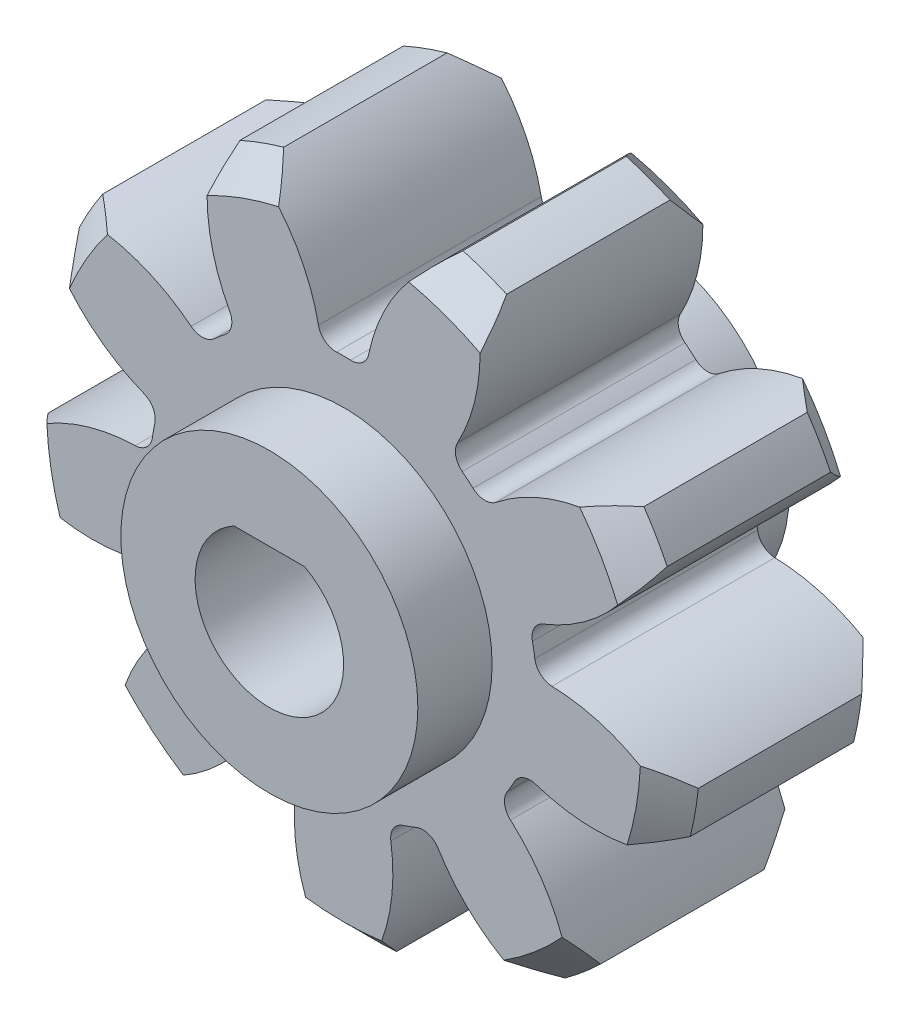
from build123d import *

# Parameters (mm, degrees)
SKICA1_R                     = 11
P_IDAT_VYSUNUT_M1_DEPTH      = 7.5
ODEBRAT_VYSUNUT_M1_DEPTH     = 7.5
ZAOBLIT1_R                   = 0.6
ZKOSEN_1_SIZE                = 1
KRUHOV_POLE1_COUNT           = 9
ZAOBLIT1_OF_KRUHOV_POLE1_R   = 0.6
P_IDAT_VYSUNUT_M2_DEPTH      = 10
P_IDAT_VYSUNUT_M2_DEPTH_BACK = 2.5
SKICA3_R                     = 5
ODEBRAT_VYSUNUT_M2_DEPTH     = 20


with BuildPart() as part:
    # Skica1 → Přidat vysunutím1 (new body)
    with BuildSketch(Plane.XY):
        Circle(SKICA1_R)
    extrude(amount=P_IDAT_VYSUNUT_M1_DEPTH)

    # Skica2 → Odebrat vysunutím1 (cut)
    with BuildSketch(Plane.XY):
        with BuildLine():
            ThreePointArc((-3.016647194, 10.578272057), (-1.490675718, 8.734840985), (-0.763082007, 6.455052738))
            ThreePointArc((-0.763082007, 6.455052738), (0, 6.5), (0.763082007, 6.455052738))
            ThreePointArc((0.763082007, 6.455052738), (1.490675718, 8.734840985), (3.016647194, 10.578272057))
            ThreePointArc((3.016647194, 10.578272057), (0, 11), (-3.016647194, 10.578272057))
        make_face()
    odebrat_vysunut_m1 = extrude(amount=ODEBRAT_VYSUNUT_M1_DEPTH, mode=Mode.SUBTRACT)

    # Zaoblit1
    zaoblit1_edges = [part.edges().sort_by_distance(p)[0] for p in [
        (-0.763082007, 6.455052738, 3.75),
        (0.763082007, 6.455052738, 3.75),
    ]]
    fillet(zaoblit1_edges, radius=ZAOBLIT1_R)

    # Zkosení1
    zkosen_1_edges = [part.edges().sort_by_distance(p)[0] for p in [
        (0, -11, 0),
        (0, -11, 7.5),
    ]]
    chamfer(zkosen_1_edges, length=ZKOSEN_1_SIZE)

    # Kruhové pole1: Odebrat vysunutím1 ×9 about axis
    kruhov_pole1_axis = Axis((0, 0, 0), (0, 0, 1))
    for i in range(1, KRUHOV_POLE1_COUNT):
        add(odebrat_vysunut_m1.rotate(kruhov_pole1_axis, i * 360 / KRUHOV_POLE1_COUNT), mode=Mode.SUBTRACT)

    # Zaoblit1 of Kruhové pole1
    zaoblit1_of_kruhov_pole1_edges = [part.edges().sort_by_distance(p)[0] for p in [
        (-4.733782651, 4.45435762, 3.75),
        (-3.564673188, 5.435356939, 3.75),
        (-6.489493782, 0.369419068, 3.75),
        (-6.224478182, 1.872397222, 3.75),
        (-5.20869865, -3.888374773, 3.75),
        (-5.971780658, -2.566677965, 3.75),
        (-1.490695531, -6.326754842, 3.75),
        (-2.924820594, -5.804776007, 3.75),
        (2.924820594, -5.804776007, 3.75),
        (1.490695531, -6.326754842, 3.75),
        (5.971780658, -2.566677965, 3.75),
        (5.20869865, -3.888374773, 3.75),
        (6.224478182, 1.872397222, 3.75),
        (6.489493782, 0.369419068, 3.75),
        (3.564673188, 5.435356939, 3.75),
        (4.733782651, 4.45435762, 3.75),
    ]]
    fillet(zaoblit1_of_kruhov_pole1_edges, radius=ZAOBLIT1_OF_KRUHOV_POLE1_R)

    # Skica3 → Přidat vysunutím2 (add, two sides: drawn at the far end of the back side and taken through both)
    with BuildSketch(Plane.XY.offset(-P_IDAT_VYSUNUT_M2_DEPTH_BACK)):
        Circle(SKICA3_R)
    extrude(amount=P_IDAT_VYSUNUT_M2_DEPTH + P_IDAT_VYSUNUT_M2_DEPTH_BACK)

    # Skica5 → Odebrat vysunutím2 (cut)
    with BuildSketch(Plane.XY.offset(10)):
        with BuildLine():
            Line((-1.187434209, 2.2), (1.187434209, 2.2))
            ThreePointArc((1.187434209, 2.2), (0, -2.5), (-1.187434209, 2.2))
        make_face()
    extrude(amount=-ODEBRAT_VYSUNUT_M2_DEPTH, mode=Mode.SUBTRACT)


solid = part.part
